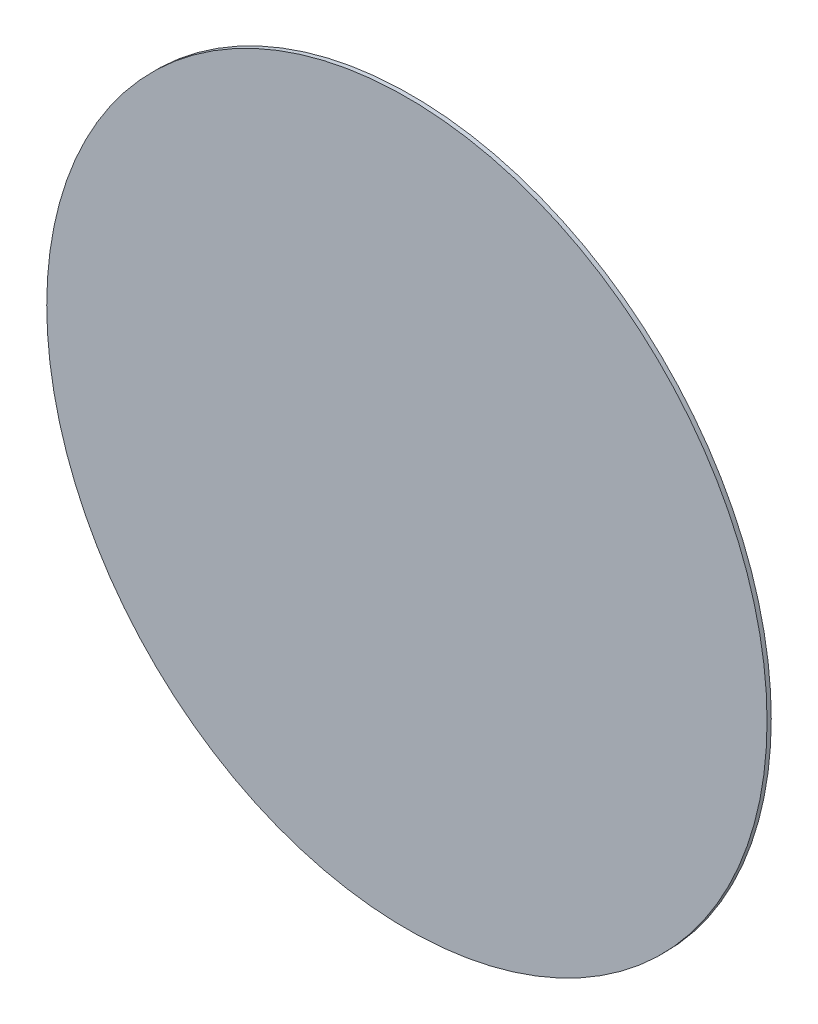
from build123d import *

# Parameters (mm, degrees)
SKETCH1_R           = 15.24
BOSS_EXTRUDE1_DEPTH = 0.1778


with BuildPart() as part:
    # Sketch1 → Boss-Extrude1 (new body)
    with BuildSketch(Plane.XY):
        Circle(SKETCH1_R)
    extrude(amount=BOSS_EXTRUDE1_DEPTH)


solid = part.part
